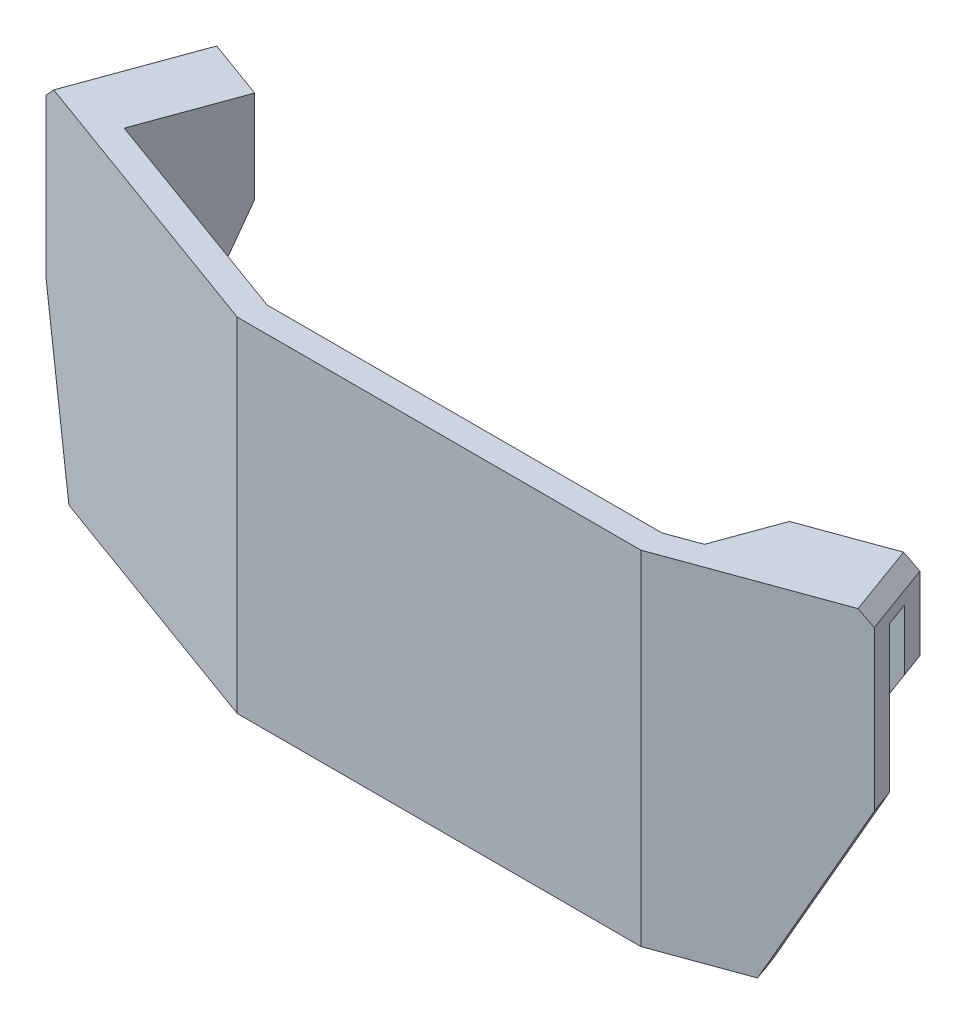
from build123d import *

# Parameters (mm, degrees)
BOSS_EXTRUDE4_DEPTH = 2
BOSS_EXTRUDE7_DEPTH = 25
BOSS_EXTRUDE8_DEPTH = 11.5
CUT_EXTRUDE4_DEPTH  = 2
CUT_EXTRUDE5_DEPTH  = 2
CUT_EXTRUDE6_DEPTH  = 2
CHAMFER2_SIZE       = 1
CUT_EXTRUDE8_REACH  = 74.555


with BuildPart() as part:
    # Sketch8 → Boss-Extrude4 (new body)
    with BuildSketch(Plane(origin=(0, 0, 0), x_dir=(1, 0, 0), z_dir=(0, 1, 0))):
        Polygon((19.761418396, 5.799677564), (27.278959362, 8.535838711), (29.331080222, 2.897682986), (15.874806811, -2), (-15.874806811, -2), (-39.501605359, 6.599451403), (-36.081403926, 15.996377611), (-30.443248201, 13.944256751), (-33.179409348, 6.426715784), (-15.522152849, 0), (15.522152849, 0), (17.975516043, 0.892951176), align=None)
    extrude(amount=BOSS_EXTRUDE4_DEPTH)

    # Sketch12 → Boss-Extrude7 (add)
    with BuildSketch(Plane.XZ):
        Polygon((-39.501605359, -6.599451403), (-15.874806811, 2), (15.874806811, 2), (29.331080222, -2.897682986), (28.647039935, -4.777068227), (17.975516043, -0.892951176), (15.522152849, 0), (-15.522152849, 0), (-33.179409348, -6.426715784), (-38.817565073, -8.478836644), align=None)
    extrude(amount=BOSS_EXTRUDE7_DEPTH)

    # Sketch13 → Boss-Extrude8 (add)
    with BuildSketch(Plane.XZ):
        Polygon((-34.202018685, -15.312337324), (-36.081403926, -15.996377611), (-38.133524786, -10.358221886), (-36.254139544, -9.674181599), align=None)
        Polygon((-32.322633443, -14.628297037), (-30.443248201, -13.944256751), (-33.179409348, -6.426715784), (-35.05879459, -7.110756071), align=None)
        Polygon((19.761418396, -5.799677564), (27.278959362, -8.535838711), (27.962999649, -6.656453469), (18.868467219, -3.34631437), align=None)
    extrude(amount=BOSS_EXTRUDE8_DEPTH)

    # Sketch15 → Cut-Extrude4 (cut)
    with BuildSketch(Plane(origin=(0.447666384, 0, 1.22995328), x_dir=(-0.9396926207859031, 0, 0.34202014332568326), z_dir=(-0.34202014332568326, 0, -0.9396926207859031))):
        Polygon((-24.553265595, -11.5), (-28.553265595, -4.75), (-28.553265595, -11.5), align=None)
    extrude(amount=-CUT_EXTRUDE4_DEPTH, mode=Mode.SUBTRACT)

    # Sketch16 → Cut-Extrude5 (cut)
    with BuildSketch(Plane(origin=(2.499787244, 0, 6.868109005), x_dir=(0.9396926207859029, 0, -0.3420201433256841), z_dir=(0.34202014332568403, 0, 0.9396926207859028))):
        Polygon((21.393332062, -25), (28.553265595, -11.5), (28.553265595, -25), align=None)
    extrude(amount=-CUT_EXTRUDE5_DEPTH, mode=Mode.SUBTRACT)

    # Sketch17 → Cut-Extrude6 (cut)
    with BuildSketch(Plane(origin=(-2.499787244, 0, 6.868109005), x_dir=(0.9396926207859133, 0, 0.3420201433256553), z_dir=(-0.3420201433256553, 0, 0.9396926207859133))):
        Polygon((-39.37651238, -25), (-39.37651238, -11.5), (-36.37651238, -25), align=None)
    extrude(amount=-CUT_EXTRUDE6_DEPTH, mode=Mode.SUBTRACT)

    # Chamfer2
    chamfer2_edges = [part.edges().sort_by_distance(p)[0] for p in [
        (-37.791504643, 2, -11.297914507),
        (28.305019792, 2, -5.716760848),
    ]]
    chamfer(chamfer2_edges, length=CHAMFER2_SIZE)

    # Cut-Extrude8: up to this face of the body (flat: up to its plane)
    cut_extrude8_end = Plane(part.part.faces().sort_by_distance((-31.811328775, -4.75, -10.185486267))[0])
    # Sketch23 → Cut-Extrude8 (cut, up to the picked face)
    with BuildSketch(Plane(origin=(-37.001818116, 0, -13.467560408), x_dir=(-0.3420201433256551, 0, 0.9396926207859133), z_dir=(-0.9396926207859133, 0, -0.3420201433256551)), mode=Mode.PRIVATE) as cut_extrude8_sk1:
        Polygon((0.308888942, -11.5), (-2.691111058, -5.25), (-2.691111058, -11.5), align=None)
    cut_extrude8_tool1 = split(extrude(cut_extrude8_sk1.sketch, amount=-CUT_EXTRUDE8_REACH, mode=Mode.PRIVATE), bisect_by=cut_extrude8_end, keep=Keep.BOTH, mode=Mode.PRIVATE)
    add(cut_extrude8_tool1.solids().sort_by(Axis((-36.423424, -9.416667, -15.056685), (0.9396926207859133, 0, 0.3420201433256551)))[0], mode=Mode.SUBTRACT)


solid = part.part
